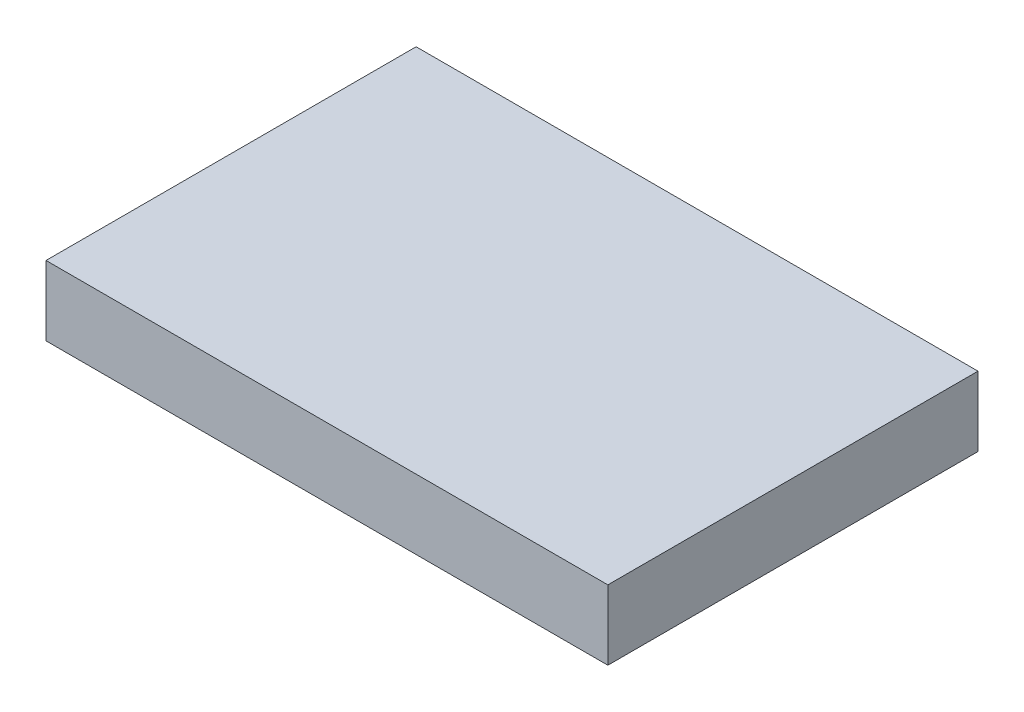
from build123d import *

# Parameters (mm, degrees)
SKETCH1_W           = 80.693902822
SKETCH1_H           = 53.157407794
BOSS_EXTRUDE1_DEPTH = 10


with BuildPart() as part:
    # Sketch1 → Boss-Extrude1 (new body)
    with BuildSketch(Plane(origin=(0, 0, 0), x_dir=(1, 0, 0), z_dir=(0, 1, 0))):
        with Locations((40.346951411, 26.578703897)):
            Rectangle(SKETCH1_W, SKETCH1_H)
    extrude(amount=BOSS_EXTRUDE1_DEPTH)


solid = part.part
